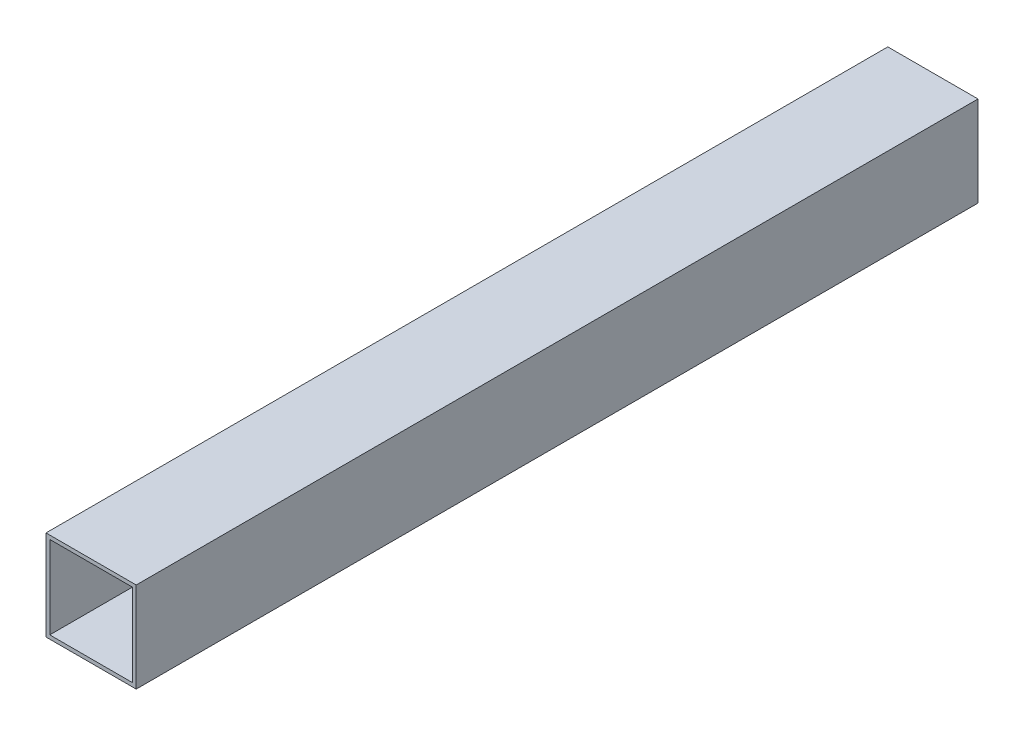
from build123d import *

# Parameters (mm, degrees)
SKETCH2_W           = 76.2
SKETCH2_H           = 76.2
BOSS_EXTRUDE1_DEPTH = 711.2
SKETCH3_W           = 69.85
SKETCH3_H           = 69.85
CUT_EXTRUDE1_DEPTH  = 838.2


with BuildPart() as part:
    # Sketch2 → Boss-Extrude1 (new body)
    with BuildSketch(Plane.XY):
        with Locations((-2.629709588, -19.469024582)):
            Rectangle(SKETCH2_W, SKETCH2_H)
    extrude(amount=BOSS_EXTRUDE1_DEPTH)

    # Sketch3 → Cut-Extrude1 (cut)
    with BuildSketch(Plane.XY.offset(711.2)):
        with Locations((-2.629709588, -19.469024582)):
            Rectangle(SKETCH3_W, SKETCH3_H)
    extrude(amount=-CUT_EXTRUDE1_DEPTH, mode=Mode.SUBTRACT)


solid = part.part
